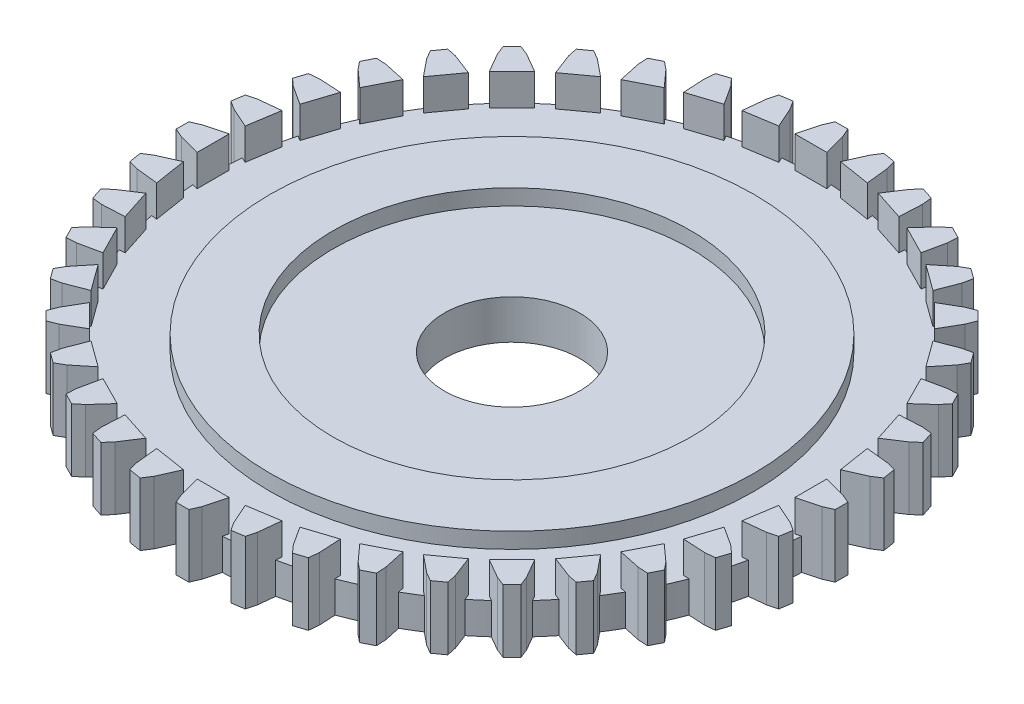
from build123d import *

# Parameters (mm, degrees)
SKETCH2_R                = 19.372274478
SKETCH2_R_2              = 4.3
BOSS_EXTRUDE1_DEPTH      = 2
BOSS_EXTRUDE2_DEPTH      = 4
CIRPATTERN1_COUNT        = 40
BOSS_EXTRUDE3_DEPTH      = 0.5
BOSS_EXTRUDE3_DEPTH_BACK = 2.5
SKETCH3_R                = 7.5
SKETCH3_R_2              = 4.3
CUT_EXTRUDE1_START       = -0.5
SKETCH4_R                = 7.5
SKETCH4_R_2              = 4.3
CUT_EXTRUDE1_DEPTH       = 0.5
BOSS_EXTRUDE4_DEPTH      = 1
BOSS_EXTRUDE4_DEPTH_BACK = 2.5
SKETCH5_R                = 15.372274478
SKETCH5_R_2              = 11.372274478


with BuildPart() as part:
    # Sketch2 → Boss-Extrude1 (new body)
    with BuildSketch(Plane(origin=(0, 0, 0), x_dir=(1, 0, 0), z_dir=(0, 1, 0))):
        with Locations(Location((0, 0, 0), (0, 0, 270))):
            Circle(SKETCH2_R)
        with Locations(Location((0, 0, 0), (0, 0, 270))):
            Circle(SKETCH2_R_2, mode=Mode.SUBTRACT)
    extrude(amount=BOSS_EXTRUDE1_DEPTH)

    # Sketch1 → Boss-Extrude2 (add)
    with BuildSketch(Plane(origin=(0, 0, 0), x_dir=(1, 0, 0), z_dir=(0, 1, 0))):
        Polygon((-1.022500925, 19), (-0.655291427, 20.370444504), (-0.4, 20.95), (0.4, 20.95), (0.655291427, 20.370444504), (1.022500925, 19), align=None)
    boss_extrude2 = extrude(amount=BOSS_EXTRUDE2_DEPTH)

    # CirPattern1: Boss-Extrude2 ×40 about axis
    cirpattern1_axis = Axis((0, 0, 0), (0, 1, 0))
    for i in range(1, CIRPATTERN1_COUNT):
        add(boss_extrude2.rotate(cirpattern1_axis, i * 360 / CIRPATTERN1_COUNT))

    # Sketch3 → Boss-Extrude3 (add, two sides: drawn at the far end of the back side and taken through both)
    with BuildSketch(Plane(origin=(0, 2, 0), x_dir=(1, 0, 0), z_dir=(0, 1, 0)).offset(-BOSS_EXTRUDE3_DEPTH_BACK)):
        with Locations(Location((0, 0, 0), (0, 0, 270))):
            Circle(SKETCH3_R)
        with Locations(Location((0, 0, 0), (0, 0, 270))):
            Circle(SKETCH3_R_2, mode=Mode.SUBTRACT)
    extrude(amount=BOSS_EXTRUDE3_DEPTH + BOSS_EXTRUDE3_DEPTH_BACK)

    # Sketch4 → Cut-Extrude1 (cut)
    with BuildSketch(Plane(origin=(0, 2.5, 0), x_dir=(1, 0, 0), z_dir=(0, 1, 0)).offset(CUT_EXTRUDE1_START)):
        with Locations(Location((0, 0, 0), (0, 0, 270))):
            Circle(SKETCH4_R)
        with Locations(Location((0, 0, 0), (0, 0, 270))):
            Circle(SKETCH4_R_2, mode=Mode.SUBTRACT)
    extrude(amount=CUT_EXTRUDE1_DEPTH, mode=Mode.SUBTRACT)

    # Sketch5 → Boss-Extrude4 (add, two sides: drawn at the far end of the back side and taken through both)
    with BuildSketch(Plane(origin=(0, 2, 0), x_dir=(1, 0, 0), z_dir=(0, 1, 0)).offset(-BOSS_EXTRUDE4_DEPTH_BACK)):
        with Locations(Location((0, 0, 0), (0, 0, 270))):
            Circle(SKETCH5_R)
        with Locations(Location((0, 0, 0), (0, 0, 270))):
            Circle(SKETCH5_R_2, mode=Mode.SUBTRACT)
    extrude(amount=BOSS_EXTRUDE4_DEPTH + BOSS_EXTRUDE4_DEPTH_BACK)


solid = part.part
